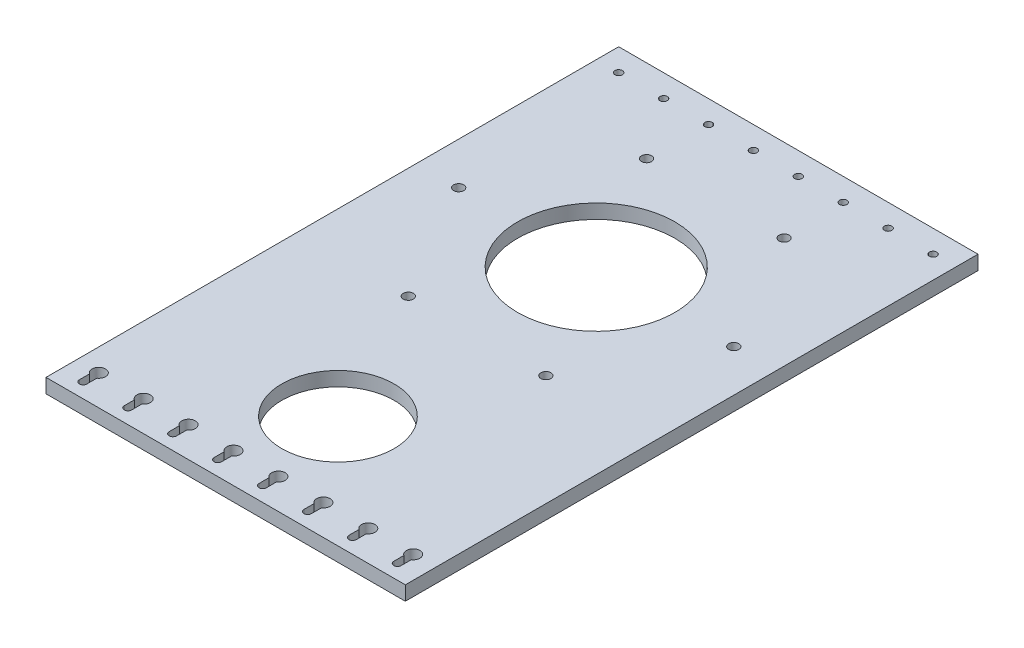
from build123d import *

# Parameters (mm, degrees)
SKETCH1_W           = 160
SKETCH1_H           = 255
SKETCH1_R           = 35
SKETCH1_R_2         = 25
SKETCH1_R_3         = 2.25
SKETCH1_R_4         = 1.65
BOSS_EXTRUDE1_DEPTH = 6.35
CUT_EXTRUDE1_REACH  = 303.107
SKETCH2_R           = 3


with BuildPart() as part:
    # Sketch1 → Boss-Extrude1 (new body)
    with BuildSketch(Plane(origin=(0, 0, 0), x_dir=(1, 0, 0), z_dir=(0, 1, 0))):
        with Locations((80, 127.5)):
            Rectangle(SKETCH1_W, SKETCH1_H)
        with Locations(Location((80, 165, 0), (0, 0, 270))):
            Circle(SKETCH1_R, mode=Mode.SUBTRACT)
        with Locations(Location((80, 50, 0), (0, 0, 270))):
            Circle(SKETCH1_R_2, mode=Mode.SUBTRACT)
        with Locations(Location((141.25, 165, 0), (0, 0, 270))):
            Circle(SKETCH1_R_3, mode=Mode.SUBTRACT)
        with Locations(Location((110.625, 111.955944018, 0), (0, 0, 270))):
            Circle(SKETCH1_R_3, mode=Mode.SUBTRACT)
        with Locations(Location((49.375, 111.955944018, 0), (0, 0, 270))):
            Circle(SKETCH1_R_3, mode=Mode.SUBTRACT)
        with Locations(Location((18.75, 165, 0), (0, 0, 270))):
            Circle(SKETCH1_R_3, mode=Mode.SUBTRACT)
        with Locations(Location((49.375, 218.044055982, 0), (0, 0, 270))):
            Circle(SKETCH1_R_3, mode=Mode.SUBTRACT)
        with Locations(Location((110.625, 218.044055982, 0), (0, 0, 270))):
            Circle(SKETCH1_R_3, mode=Mode.SUBTRACT)
        with Locations(Location((10, 245, 0), (0, 0, 270))):
            Circle(SKETCH1_R_4, mode=Mode.SUBTRACT)
        with Locations(Location((30, 245, 0), (0, 0, 270))):
            Circle(SKETCH1_R_4, mode=Mode.SUBTRACT)
        with Locations(Location((50, 245, 0), (0, 0, 270))):
            Circle(SKETCH1_R_4, mode=Mode.SUBTRACT)
        with Locations(Location((70, 245, 0), (0, 0, 270))):
            Circle(SKETCH1_R_4, mode=Mode.SUBTRACT)
        with Locations(Location((90, 245, 0), (0, 0, 270))):
            Circle(SKETCH1_R_4, mode=Mode.SUBTRACT)
        with Locations(Location((110, 245, 0), (0, 0, 270))):
            Circle(SKETCH1_R_4, mode=Mode.SUBTRACT)
        with Locations(Location((130, 245, 0), (0, 0, 270))):
            Circle(SKETCH1_R_4, mode=Mode.SUBTRACT)
        with Locations(Location((150, 245, 0), (0, 0, 270))):
            Circle(SKETCH1_R_4, mode=Mode.SUBTRACT)
        with BuildLine():
            Line((8.35, 6.5), (8.35, 13.5))
            ThreePointArc((8.35, 13.5), (10, 15.15), (11.65, 13.5))
            Line((11.65, 13.5), (11.65, 6.5))
            ThreePointArc((11.65, 6.5), (10, 4.85), (8.35, 6.5))
        make_face(mode=Mode.SUBTRACT)
        with BuildLine():
            Line((31.65, 6.5), (31.65, 13.5))
            ThreePointArc((31.65, 13.5), (30, 15.15), (28.35, 13.5))
            Line((28.35, 13.5), (28.35, 6.5))
            ThreePointArc((28.35, 6.5), (30, 4.85), (31.65, 6.5))
        make_face(mode=Mode.SUBTRACT)
        with BuildLine():
            Line((51.65, 6.5), (51.65, 13.5))
            ThreePointArc((51.65, 13.5), (50, 15.15), (48.35, 13.5))
            Line((48.35, 13.5), (48.35, 6.5))
            ThreePointArc((48.35, 6.5), (50, 4.85), (51.65, 6.5))
        make_face(mode=Mode.SUBTRACT)
        with BuildLine():
            Line((71.65, 6.5), (71.65, 13.5))
            ThreePointArc((71.65, 13.5), (70, 15.15), (68.35, 13.5))
            Line((68.35, 13.5), (68.35, 6.5))
            ThreePointArc((68.35, 6.5), (70, 4.85), (71.65, 6.5))
        make_face(mode=Mode.SUBTRACT)
        with BuildLine():
            Line((91.65, 6.5), (91.65, 13.5))
            ThreePointArc((91.65, 13.5), (90, 15.15), (88.35, 13.5))
            Line((88.35, 13.5), (88.35, 6.5))
            ThreePointArc((88.35, 6.5), (90, 4.85), (91.65, 6.5))
        make_face(mode=Mode.SUBTRACT)
        with BuildLine():
            Line((111.65, 6.5), (111.65, 13.5))
            ThreePointArc((111.65, 13.5), (110, 15.15), (108.35, 13.5))
            Line((108.35, 13.5), (108.35, 6.5))
            ThreePointArc((108.35, 6.5), (110, 4.85), (111.65, 6.5))
        make_face(mode=Mode.SUBTRACT)
        with BuildLine():
            Line((131.65, 6.5), (131.65, 13.5))
            ThreePointArc((131.65, 13.5), (130, 15.15), (128.35, 13.5))
            Line((128.35, 13.5), (128.35, 6.5))
            ThreePointArc((128.35, 6.5), (130, 4.85), (131.65, 6.5))
        make_face(mode=Mode.SUBTRACT)
        with BuildLine():
            Line((151.65, 6.5), (151.65, 13.5))
            ThreePointArc((151.65, 13.5), (150, 15.15), (148.35, 13.5))
            Line((148.35, 13.5), (148.35, 6.5))
            ThreePointArc((148.35, 6.5), (150, 4.85), (151.65, 6.5))
        make_face(mode=Mode.SUBTRACT)
    extrude(amount=BOSS_EXTRUDE1_DEPTH)

    # Sketch2 → Cut-Extrude1 (cut, up to next)
    with BuildSketch(Plane(origin=(0, 6.35, 0), x_dir=(1, 0, 0), z_dir=(0, 1, 0)), mode=Mode.PRIVATE) as cut_extrude1_sk1:
        with Locations((150, 13.5)):
            Circle(SKETCH2_R)
    cut_extrude1_tool1 = extrude(cut_extrude1_sk1.sketch, amount=-CUT_EXTRUDE1_REACH, mode=Mode.PRIVATE) & part.part
    # Sketch2 → Cut-Extrude1 (cut, up to next)
    with BuildSketch(Plane(origin=(0, 6.35, 0), x_dir=(1, 0, 0), z_dir=(0, 1, 0)), mode=Mode.PRIVATE) as cut_extrude1_sk2:
        with Locations((130, 13.5)):
            Circle(SKETCH2_R)
    cut_extrude1_tool2 = extrude(cut_extrude1_sk2.sketch, amount=-CUT_EXTRUDE1_REACH, mode=Mode.PRIVATE) & part.part
    # Sketch2 → Cut-Extrude1 (cut, up to next)
    with BuildSketch(Plane(origin=(0, 6.35, 0), x_dir=(1, 0, 0), z_dir=(0, 1, 0)), mode=Mode.PRIVATE) as cut_extrude1_sk3:
        with Locations((110, 13.5)):
            Circle(SKETCH2_R)
    cut_extrude1_tool3 = extrude(cut_extrude1_sk3.sketch, amount=-CUT_EXTRUDE1_REACH, mode=Mode.PRIVATE) & part.part
    # Sketch2 → Cut-Extrude1 (cut, up to next)
    with BuildSketch(Plane(origin=(0, 6.35, 0), x_dir=(1, 0, 0), z_dir=(0, 1, 0)), mode=Mode.PRIVATE) as cut_extrude1_sk4:
        with Locations((90, 13.5)):
            Circle(SKETCH2_R)
    cut_extrude1_tool4 = extrude(cut_extrude1_sk4.sketch, amount=-CUT_EXTRUDE1_REACH, mode=Mode.PRIVATE) & part.part
    # Sketch2 → Cut-Extrude1 (cut, up to next)
    with BuildSketch(Plane(origin=(0, 6.35, 0), x_dir=(1, 0, 0), z_dir=(0, 1, 0)), mode=Mode.PRIVATE) as cut_extrude1_sk5:
        with Locations((70, 13.5)):
            Circle(SKETCH2_R)
    cut_extrude1_tool5 = extrude(cut_extrude1_sk5.sketch, amount=-CUT_EXTRUDE1_REACH, mode=Mode.PRIVATE) & part.part
    # Sketch2 → Cut-Extrude1 (cut, up to next)
    with BuildSketch(Plane(origin=(0, 6.35, 0), x_dir=(1, 0, 0), z_dir=(0, 1, 0)), mode=Mode.PRIVATE) as cut_extrude1_sk6:
        with Locations((50, 13.5)):
            Circle(SKETCH2_R)
    cut_extrude1_tool6 = extrude(cut_extrude1_sk6.sketch, amount=-CUT_EXTRUDE1_REACH, mode=Mode.PRIVATE) & part.part
    # Sketch2 → Cut-Extrude1 (cut, up to next)
    with BuildSketch(Plane(origin=(0, 6.35, 0), x_dir=(1, 0, 0), z_dir=(0, 1, 0)), mode=Mode.PRIVATE) as cut_extrude1_sk7:
        with Locations((30, 13.5)):
            Circle(SKETCH2_R)
    cut_extrude1_tool7 = extrude(cut_extrude1_sk7.sketch, amount=-CUT_EXTRUDE1_REACH, mode=Mode.PRIVATE) & part.part
    # Sketch2 → Cut-Extrude1 (cut, up to next)
    with BuildSketch(Plane(origin=(0, 6.35, 0), x_dir=(1, 0, 0), z_dir=(0, 1, 0)), mode=Mode.PRIVATE) as cut_extrude1_sk8:
        with Locations((10, 13.5)):
            Circle(SKETCH2_R)
    cut_extrude1_tool8 = extrude(cut_extrude1_sk8.sketch, amount=-CUT_EXTRUDE1_REACH, mode=Mode.PRIVATE) & part.part
    add(cut_extrude1_tool1.solids().sort_by_distance((150, 6.35, -13.5))[0], mode=Mode.SUBTRACT)
    add(cut_extrude1_tool2.solids().sort_by_distance((130, 6.35, -13.5))[0], mode=Mode.SUBTRACT)
    add(cut_extrude1_tool3.solids().sort_by_distance((110, 6.35, -13.5))[0], mode=Mode.SUBTRACT)
    add(cut_extrude1_tool4.solids().sort_by_distance((90, 6.35, -13.5))[0], mode=Mode.SUBTRACT)
    add(cut_extrude1_tool5.solids().sort_by_distance((70, 6.35, -13.5))[0], mode=Mode.SUBTRACT)
    add(cut_extrude1_tool6.solids().sort_by_distance((50, 6.35, -13.5))[0], mode=Mode.SUBTRACT)
    add(cut_extrude1_tool7.solids().sort_by_distance((30, 6.35, -13.5))[0], mode=Mode.SUBTRACT)
    add(cut_extrude1_tool8.solids().sort_by_distance((10, 6.35, -13.5))[0], mode=Mode.SUBTRACT)


solid = part.part
